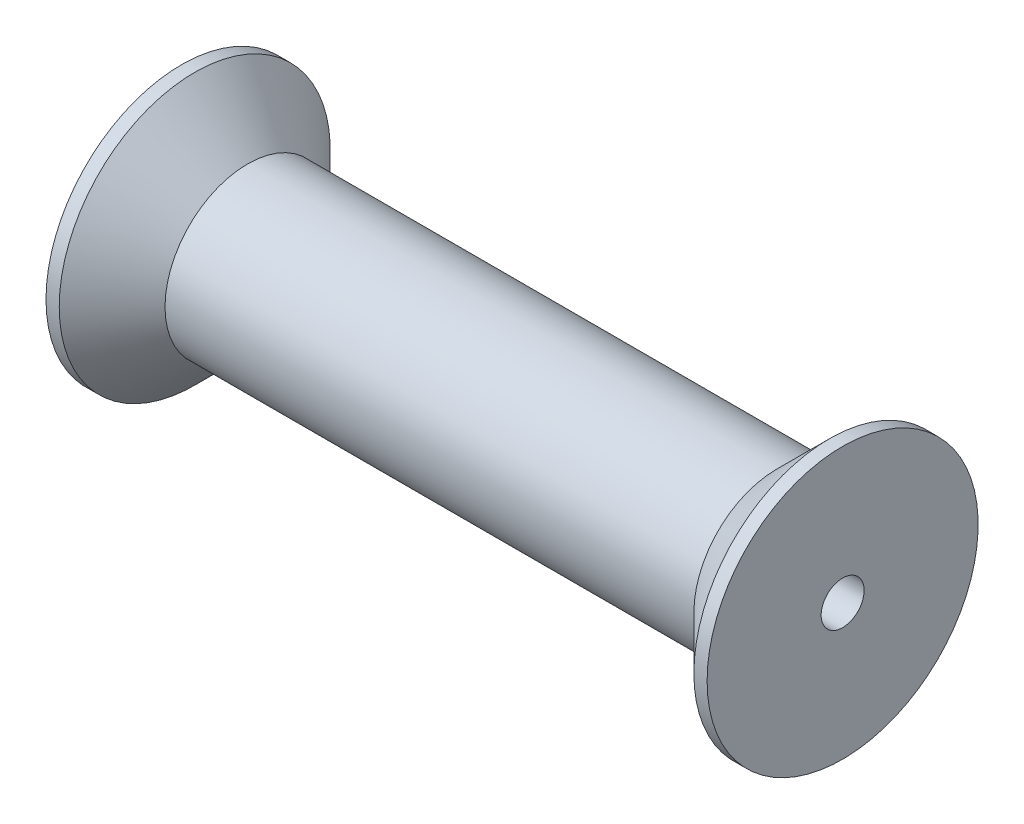
from build123d import *


with BuildPart() as part:
    # Sketch1 → Revolve1 (revolve)
    with BuildSketch(Plane.XY, mode=Mode.PRIVATE) as revolve1_sk:
        with BuildLine():
            Line((0, 3.25), (10, 3.25))
            ThreePointArc((10, 3.25), (20.351145141, 7.537584704), (31.459292144, 9))
            Line((31.459292144, 9), (68.540707856, 9))
            ThreePointArc((68.540707856, 9), (79.648854859, 7.537584704), (90, 3.25))
            Line((90, 3.25), (100, 3.25))
            Line((100, 3.25), (100, 20.5))
            Line((100, 20.5), (98, 20.5))
            Line((98, 20.5), (90, 12.5))
            Line((90, 12.5), (10, 12.5))
            Line((10, 12.5), (2, 20.5))
            Line((2, 20.5), (0, 20.5))
            Line((0, 20.5), (0, 3.25))
        make_face()
    revolve(revolve1_sk.sketch.rotate(Axis((0, 0, 0), (1, 0, 0)), 90), axis=Axis((0, 0, 0), (1, 0, 0)))


solid = part.part
